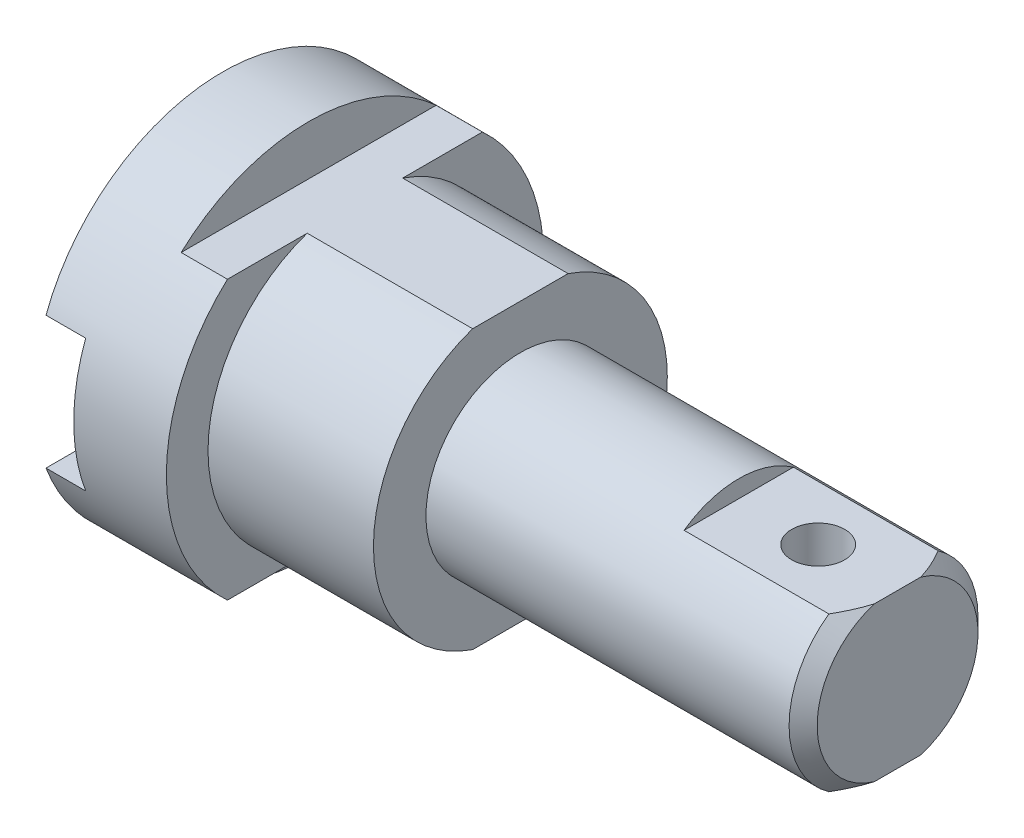
from build123d import *

# Parameters (mm, degrees)
CUT_EXTRUDE1_DEPTH      = 121.271567712
CUT_EXTRUDE1_DEPTH_BACK = 121.271567712
SKETCH1_6_W             = 6
SKETCH1_6_H             = 20
CUT_EXTRUDE2_DEPTH      = 24
SKETCH3_R               = 4
CUT_EXTRUDE3_DEPTH      = 114.258419555
CUT_EXTRUDE4_DEPTH      = 25
CUT_EXTRUDE4_DEPTH_BACK = 7


with BuildPart() as part:
    # Sketch1 → Revolve2 (revolve)
    with BuildSketch(Plane.XY):
        Polygon((0, 0), (20, 0), (20, 6.295), (45, 6.295), (45, 14.225), (99.878679656, 14.225), (102, 16.346320344), (102, 28.5), (0, 28.5), align=None)
    revolve(axis=Axis((0, 28.5, 0), (1, 0, 0)))

    # Sketch1<6> → Cut-Extrude1 (cut, two sides: drawn at the far end of the back side and taken through both)
    with BuildSketch(Plane.XY.offset(-CUT_EXTRUDE1_DEPTH_BACK)):
        with Locations((3, 28.5)):
            Rectangle(SKETCH1_6_W, SKETCH1_6_H)
    extrude(amount=CUT_EXTRUDE1_DEPTH + CUT_EXTRUDE1_DEPTH_BACK, mode=Mode.SUBTRACT)

    # Sketch2 → Cut-Extrude2 (cut)
    with BuildSketch(Plane(origin=(102, 0, 0), x_dir=(0, 0, -1), z_dir=(1, 0, 0))):
        with BuildLine():
            ThreePointArc((8.263535865, 40.14), (0, 42.775), (-8.263535865, 40.14))
            Line((-8.263535865, 40.14), (8.263535865, 40.14))
        make_face()
        with BuildLine():
            ThreePointArc((-8.263535865, 16.86), (0, 14.225), (8.263535865, 16.86))
            Line((8.263535865, 16.86), (-8.263535865, 16.86))
        make_face()
    extrude(amount=-CUT_EXTRUDE2_DEPTH, mode=Mode.SUBTRACT)

    # Sketch3 → Cut-Extrude3 (cut, through all)
    with BuildSketch(Plane(origin=(0, 40.14, 0), x_dir=(1, 0, 0), z_dir=(0, 1, 0))):
        with Locations((90, 0)):
            Circle(SKETCH3_R)
    extrude(amount=-CUT_EXTRUDE3_DEPTH, mode=Mode.SUBTRACT)

    # Sketch4 → Cut-Extrude4 (cut, two sides: drawn at the far end of the back side and taken through both)
    with BuildSketch(Plane(origin=(20, 0, 0), x_dir=(0, 0, -1), z_dir=(1, 0, 0)).offset(-CUT_EXTRUDE4_DEPTH_BACK)):
        with BuildLine():
            ThreePointArc((19.267848868, 49.5), (0, 57), (-19.267848868, 49.5))
            Line((-19.267848868, 49.5), (19.267848868, 49.5))
        make_face()
        with BuildLine():
            ThreePointArc((-19.267848868, 7.5), (0, 0), (19.267848868, 7.5))
            Line((19.267848868, 7.5), (-19.267848868, 7.5))
        make_face()
    extrude(amount=CUT_EXTRUDE4_DEPTH + CUT_EXTRUDE4_DEPTH_BACK, mode=Mode.SUBTRACT)


solid = part.part
